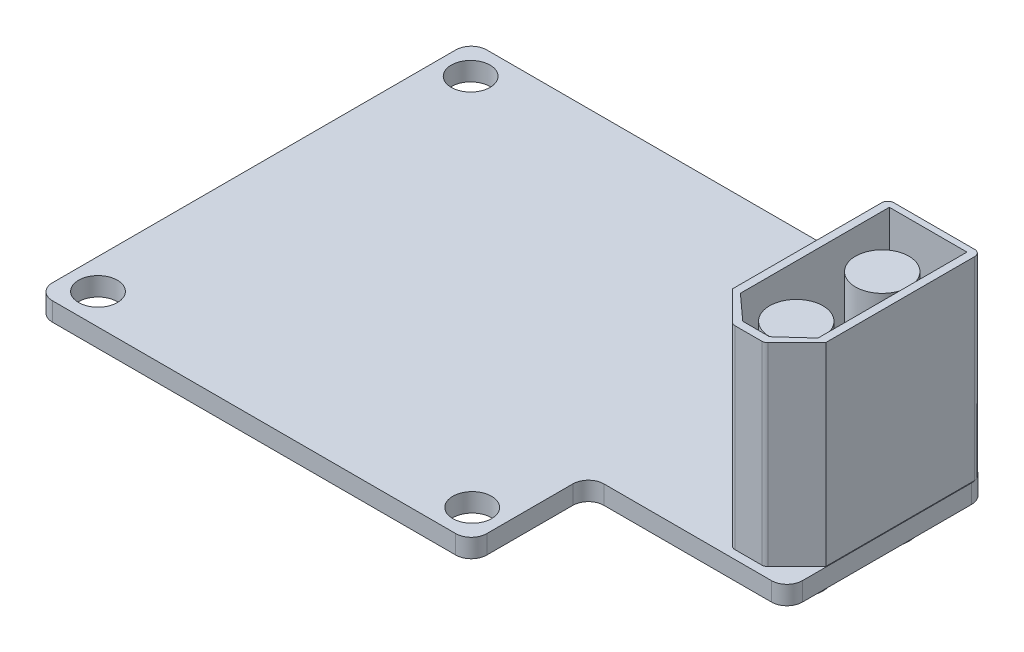
from build123d import *

# Parameters (mm, degrees)
SKETCH1_R             = 1.5875
SKETCH1_R_2           = 2.1844
BOSS_EXTRUDE2_DEPTH   = 1.524
BOSS_EXTRUDE3_DEPTH   = 15.875
SKETCH3_R             = 2.1844
BOSS_EXTRUDE4_DEPTH   = 1.778
BOSS_EXTRUDE4_2_DEPTH = 1.778
CUT_EXTRUDE1_DEPTH    = 9.398
SKETCH6_R             = 2.1844
BOSS_EXTRUDE5_DEPTH   = 16.256


with BuildPart() as part:
    # Sketch1 → Boss-Extrude2 (new body)
    with BuildSketch(Plane(origin=(0, 0, 0), x_dir=(1, 0, 0), z_dir=(0, 1, 0))):
        with BuildLine():
            Line((-50.746188486, 35.427401309), (-17.726188486, 35.427401309))
            ThreePointArc((-17.726188486, 35.427401309), (-16.828162874, 35.055426921), (-16.456188486, 34.157401309))
            Line((-16.456188486, 34.157401309), (-16.456188486, 27.108901309))
            ThreePointArc((-16.456188486, 27.108901309), (-16.084214098, 26.210875697), (-15.186188486, 25.838901309))
            Line((-15.186188486, 25.838901309), (-1.470188486, 25.838901309))
            ThreePointArc((-1.470188486, 25.838901309), (-0.572162874, 25.466926921), (-0.200188486, 24.568901309))
            Line((-0.200188486, 24.568901309), (-0.200188486, 10.725901309))
            ThreePointArc((-0.200188486, 10.725901309), (-0.572162874, 9.827875697), (-1.470188486, 9.455901309))
            Line((-1.470188486, 9.455901309), (-15.186188486, 9.455901309))
            ThreePointArc((-15.186188486, 9.455901309), (-16.084214098, 9.083926921), (-16.456188486, 8.185901309))
            Line((-16.456188486, 8.185901309), (-16.456188486, 1.137401309))
            ThreePointArc((-16.456188486, 1.137401309), (-16.828162874, 0.239375697), (-17.726188486, -0.132598691))
            Line((-17.726188486, -0.132598691), (-50.746188486, -0.132598691))
            ThreePointArc((-50.746188486, -0.132598691), (-51.644214098, 0.239375697), (-52.016188486, 1.137401309))
            Line((-52.016188486, 1.137401309), (-52.016188486, 34.157401309))
            ThreePointArc((-52.016188486, 34.157401309), (-51.644214098, 35.055426921), (-50.746188486, 35.427401309))
        make_face()
        with Locations(Location((-49.539688486, 32.900101309, 0), (0, 0, 90))):
            Circle(SKETCH1_R, mode=Mode.SUBTRACT)
        with Locations(Location((-18.907288486, 32.900101309, 0), (0, 0, 90))):
            Circle(SKETCH1_R, mode=Mode.SUBTRACT)
        with Locations(Location((-18.907288486, 2.394701309, 0), (0, 0, 90))):
            Circle(SKETCH1_R, mode=Mode.SUBTRACT)
        with Locations(Location((-49.539688486, 2.394701309, 0), (0, 0, 90))):
            Circle(SKETCH1_R, mode=Mode.SUBTRACT)
        with Locations(Location((-4.111788486, 21.165301309, 0), (0, 0, 90))):
            Circle(SKETCH1_R_2, mode=Mode.SUBTRACT)
        with Locations(Location((-4.111788486, 14.129501309, 0), (0, 0, 90))):
            Circle(SKETCH1_R_2, mode=Mode.SUBTRACT)
    extrude(amount=BOSS_EXTRUDE2_DEPTH)

    # Sketch2 → Boss-Extrude3 (add)
    with BuildSketch(Plane(origin=(0, 1.524, 0), x_dir=(1, 0, 0), z_dir=(0, 1, 0))):
        with BuildLine():
            Line((-0.249338446, 12.681643767), (-2.605441809, 10.307979525))
            ThreePointArc((-2.605441809, 10.307979525), (-2.77070914, 10.196884511), (-2.96598326, 10.157853612))
            Line((-2.96598326, 10.157853612), (-5.158955649, 10.157853612))
            ThreePointArc((-5.158955649, 10.157853612), (-5.354367589, 10.196941921), (-5.519707394, 10.308191511))
            Line((-5.519707394, 10.308191511), (-7.872832313, 12.681643767))
            Line((-7.872832313, 12.681643767), (-7.872832313, 24.873643767))
            ThreePointArc((-7.872832313, 24.873643767), (-7.724042558, 25.232854011), (-7.364832313, 25.381643767))
            Line((-7.364832313, 25.381643767), (-0.757338446, 25.381643767))
            ThreePointArc((-0.757338446, 25.381643767), (-0.398128202, 25.232854011), (-0.249338446, 24.873643767))
            Line((-0.249338446, 24.873643767), (-0.249338446, 12.681643767))
        make_face()
    extrude(amount=BOSS_EXTRUDE3_DEPTH)

    # Sketch4 → Cut-Extrude1 (cut)
    with BuildSketch(Plane(origin=(0, 17.399, 0), x_dir=(1, 0, 0), z_dir=(0, 1, 0))):
        Polygon((-7.237832313, 24.873643767), (-7.237832313, 12.681643767), (-5.158955649, 10.792853612), (-2.96598326, 10.792853612), (-0.884338446, 12.681643767), (-0.884338446, 24.873643767), align=None)
    extrude(amount=-CUT_EXTRUDE1_DEPTH, mode=Mode.SUBTRACT)



with BuildPart() as body_2:
    # Sketch3 → Boss-Extrude4 (new body)
    with BuildSketch(Plane.XZ):
        with Locations(Location((-4.111788486, -14.129501309, 0), (0, 0, 270))):
            Circle(SKETCH3_R)
    extrude(amount=BOSS_EXTRUDE4_DEPTH)


with BuildPart() as body_3:
    # Sketch3 → Boss-Extrude4 2 (new body)
    with BuildSketch(Plane.XZ):
        with Locations(Location((-4.111788486, -21.165301309, 0), (0, 0, 270))):
            Circle(SKETCH3_R)
    extrude(amount=BOSS_EXTRUDE4_2_DEPTH)


with BuildPart() as part_1:
    add(part.part)

    add(body_2.part)  # Boss-Extrude5 merges body 2

    add(body_3.part)  # Boss-Extrude5 merges body 3
    # Sketch6 → Boss-Extrude5 (add)
    with BuildSketch(Plane.XZ):
        with Locations(Location((-4.111788486, -14.129501309, 0), (0, 0, 90))):
            Circle(SKETCH6_R)
        with Locations(Location((-4.111788486, -21.165301309, 0), (0, 0, 270))):
            Circle(SKETCH6_R)
    extrude(amount=-BOSS_EXTRUDE5_DEPTH)


solid = part_1.part
